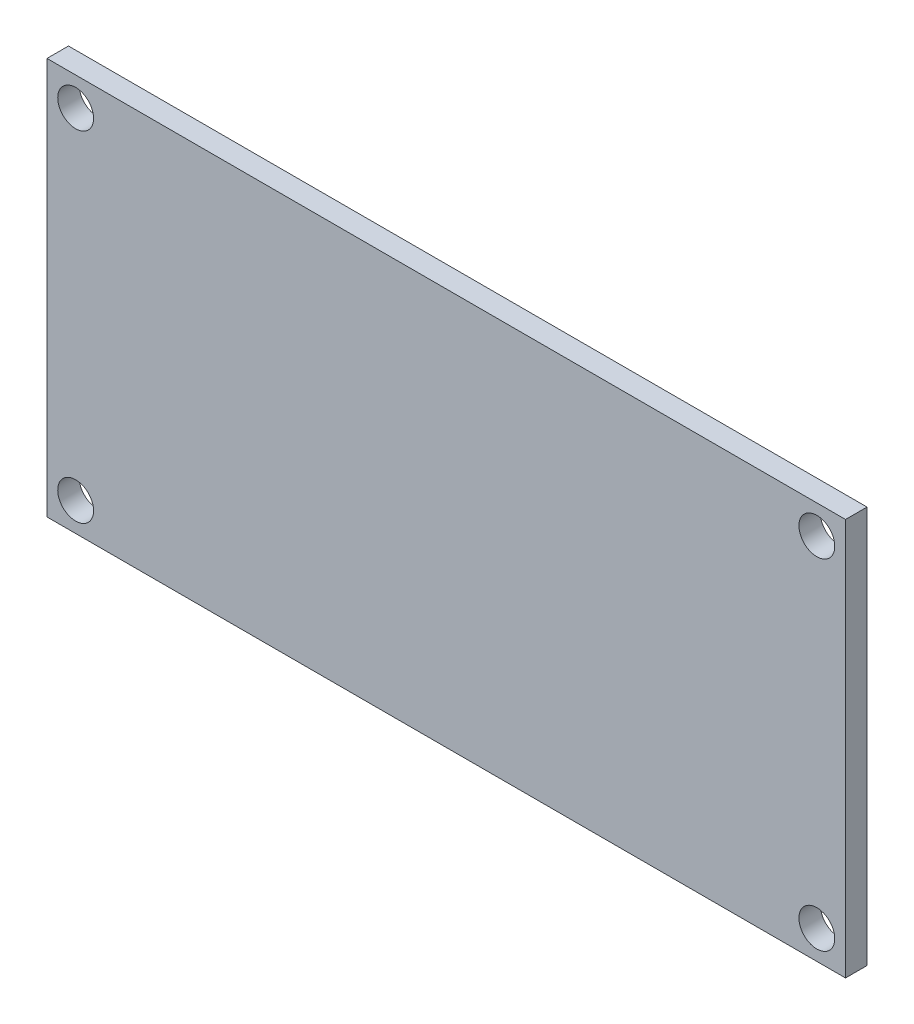
from build123d import *

# Parameters (mm, degrees)
SKETCH_1_W          = 111.4
SKETCH_1_H          = 55.4
EXTRUDE_1_DEPTH     = 3
SKETCH_2_R          = 2.5
CUT_EXTRUDE_1_DEPTH = 63.27985228


with BuildPart() as part:
    # 草图1 → 凸台-拉伸1 (new body)
    with BuildSketch(Plane.XY):
        Rectangle(SKETCH_1_W, SKETCH_1_H)
    extrude(amount=EXTRUDE_1_DEPTH)

    # 草图2 → 切除-拉伸1 (cut, through all)
    with BuildSketch(Plane(origin=(0, 0, 0), x_dir=(-1, 0, 0), z_dir=(0, 0, -1))):
        with Locations((-51.7, 23.7)):
            Circle(SKETCH_2_R)
        with Locations((-51.7, -23.7)):
            Circle(SKETCH_2_R)
        with Locations((51.7, -23.7)):
            Circle(SKETCH_2_R)
        with Locations((51.7, 23.7)):
            Circle(SKETCH_2_R)
    extrude(amount=-CUT_EXTRUDE_1_DEPTH, mode=Mode.SUBTRACT)


solid = part.part
